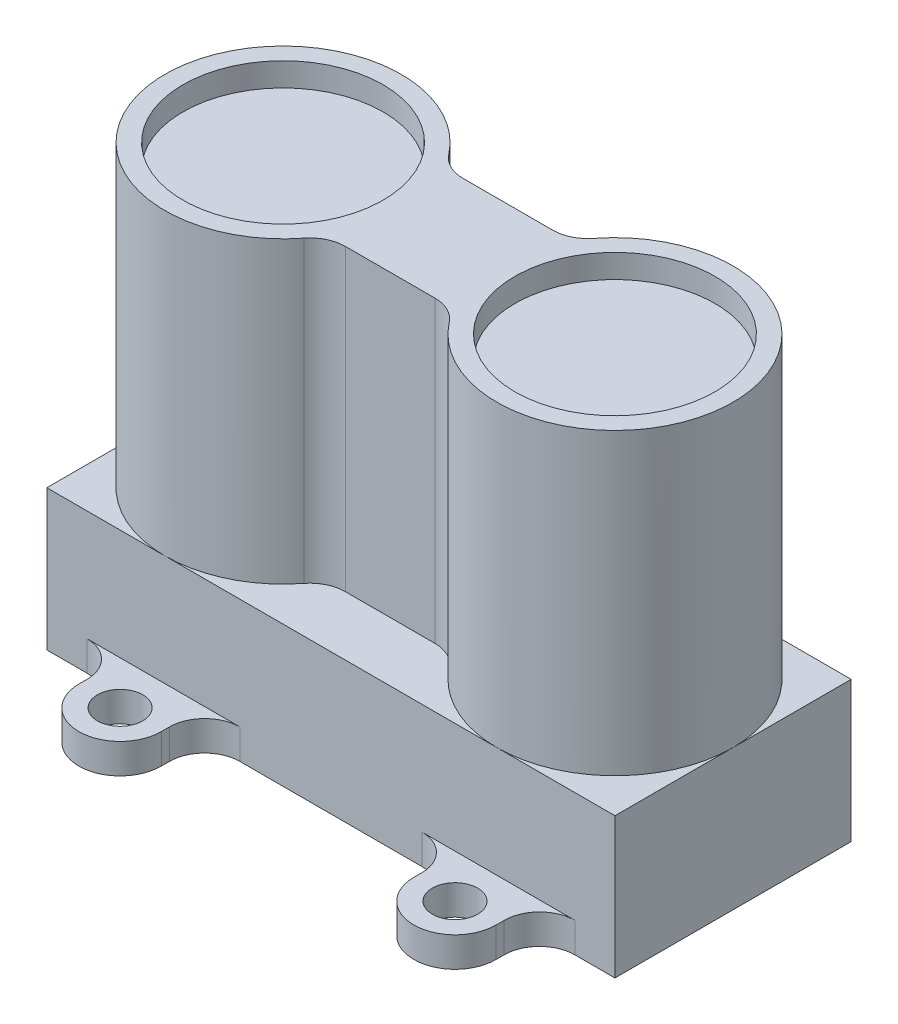
from build123d import *

# Parameters (mm, degrees)
SKETCH1_R           = 1.925
BOSS_EXTRUDE1_DEPTH = 2.54
SKETCH2_W           = 48.26
SKETCH2_H           = 20.066
BOSS_EXTRUDE2_DEPTH = 9.398
BOSS_EXTRUDE3_DEPTH = 25.4
SKETCH4_R           = 8.5
CUT_EXTRUDE1_DEPTH  = 2


with BuildPart() as part:
    # Sketch1 → Boss-Extrude1 (new body)
    with BuildSketch(Plane(origin=(0, 0, 0), x_dir=(1, 0, 0), z_dir=(0, 1, 0))):
        with BuildLine():
            Line((-24.13, 10.033), (-20.724, 10.033))
            ThreePointArc((-20.724, 10.033), (-18.602679656, 10.911679656), (-17.724, 13.033))
            Line((-17.724, 13.033), (-17.724, 13.716))
            ThreePointArc((-17.724, 13.716), (-14.224, 17.216), (-10.724, 13.716))
            Line((-10.724, 13.716), (-10.724, 13.033))
            ThreePointArc((-10.724, 13.033), (-9.845320344, 10.911679656), (-7.724, 10.033))
            Line((-7.724, 10.033), (7.724, 10.033))
            ThreePointArc((7.724, 10.033), (9.845320344, 10.911679656), (10.724, 13.033))
            Line((10.724, 13.033), (10.724, 13.716))
            ThreePointArc((10.724, 13.716), (14.224, 17.216), (17.724, 13.716))
            Line((17.724, 13.716), (17.724, 13.033))
            ThreePointArc((17.724, 13.033), (18.602679656, 10.911679656), (20.724, 10.033))
            Line((20.724, 10.033), (24.13, 10.033))
            Line((24.13, 10.033), (24.13, -10.033))
            Line((24.13, -10.033), (20.724, -10.033))
            ThreePointArc((20.724, -10.033), (18.602679656, -10.911679656), (17.724, -13.033))
            Line((17.724, -13.033), (17.724, -13.716))
            ThreePointArc((17.724, -13.716), (14.224, -17.216), (10.724, -13.716))
            Line((10.724, -13.716), (10.724, -13.033))
            ThreePointArc((10.724, -13.033), (9.845320344, -10.911679656), (7.724, -10.033))
            Line((7.724, -10.033), (-7.724, -10.033))
            ThreePointArc((-7.724, -10.033), (-9.845320344, -10.911679656), (-10.724, -13.033))
            Line((-10.724, -13.033), (-10.724, -13.716))
            ThreePointArc((-10.724, -13.716), (-14.224, -17.216), (-17.724, -13.716))
            Line((-17.724, -13.716), (-17.724, -13.033))
            ThreePointArc((-17.724, -13.033), (-18.602679656, -10.911679656), (-20.724, -10.033))
            Line((-20.724, -10.033), (-24.13, -10.033))
            Line((-24.13, -10.033), (-24.13, 10.033))
        make_face()
        with Locations(Location((-14.224, 13.716, 0), (0, 0, 270))):
            Circle(SKETCH1_R, mode=Mode.SUBTRACT)
        with Locations(Location((-14.224, -13.716, 0), (0, 0, 90))):
            Circle(SKETCH1_R, mode=Mode.SUBTRACT)
        with Locations(Location((14.224, -13.716, 0), (0, 0, 270))):
            Circle(SKETCH1_R, mode=Mode.SUBTRACT)
        with Locations(Location((14.224, 13.716, 0), (0, 0, 90))):
            Circle(SKETCH1_R, mode=Mode.SUBTRACT)
    extrude(amount=BOSS_EXTRUDE1_DEPTH)

    # Sketch2 → Boss-Extrude2 (add)
    with BuildSketch(Plane(origin=(0, 2.54, 0), x_dir=(1, 0, 0), z_dir=(0, 1, 0))):
        Rectangle(SKETCH2_W, SKETCH2_H)
    extrude(amount=BOSS_EXTRUDE2_DEPTH)

    # Sketch3 → Boss-Extrude3 (add)
    with BuildSketch(Plane(origin=(0, 11.938, 0), x_dir=(1, 0, 0), z_dir=(0, 1, 0))):
        with BuildLine():
            Line((-3.808215378, 5), (3.808215378, 5))
            ThreePointArc((3.808215378, 5), (5.126464602, 5.305149544), (6.176538394, 6.158520678))
            ThreePointArc((6.176538394, 6.158520678), (24.13, 0), (6.176538394, -6.158520678))
            ThreePointArc((6.176538394, -6.158520678), (5.126464602, -5.305149544), (3.808215378, -5))
            Line((3.808215378, -5), (-3.808215378, -5))
            ThreePointArc((-3.808215378, -5), (-5.126464602, -5.305149544), (-6.176538394, -6.158520678))
            ThreePointArc((-6.176538394, -6.158520678), (-24.13, 0), (-6.176538394, 6.158520678))
            ThreePointArc((-6.176538394, 6.158520678), (-5.126464602, 5.305149544), (-3.808215378, 5))
        make_face()
    extrude(amount=BOSS_EXTRUDE3_DEPTH)

    # Sketch4 → Cut-Extrude1 (cut)
    with BuildSketch(Plane(origin=(0, 37.338, 0), x_dir=(1, 0, 0), z_dir=(0, 1, 0))):
        with Locations(Location((14.097, 0, 0), (0, 0, 270))):
            Circle(SKETCH4_R)
        with Locations(Location((-14.097, 0, 0), (0, 0, 90))):
            Circle(SKETCH4_R)
    extrude(amount=-CUT_EXTRUDE1_DEPTH, mode=Mode.SUBTRACT)


solid = part.part
